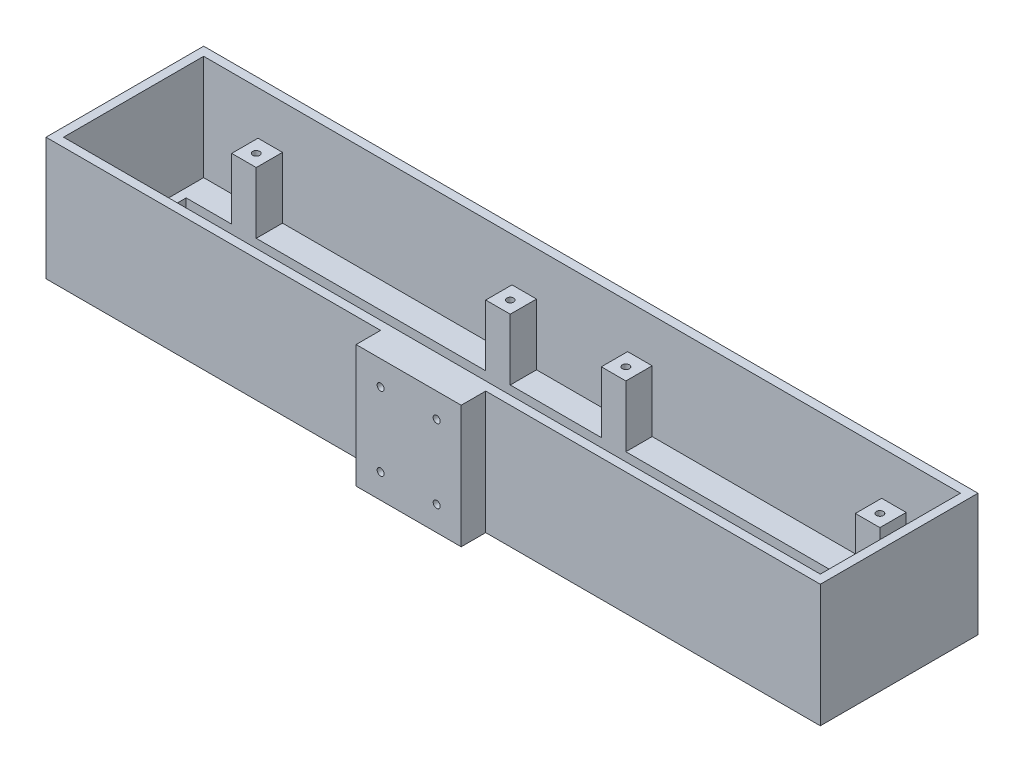
from build123d import *

# Parameters (mm, degrees)
SKETCH1_W           = 221
SKETCH1_H           = 45
BOSS_EXTRUDE1_DEPTH = 5
SKETCH2_W           = 211
SKETCH2_H           = 25
CUT_EXTRUDE1_DEPTH  = 2.5
SKETCH3_R           = 8
CUT_EXTRUDE2_DEPTH  = 2.5
SKETCH6_W           = 221
SKETCH6_H           = 45
SKETCH6_W_2         = 216
SKETCH6_H_2         = 40
BOSS_EXTRUDE3_DEPTH = 30
SKETCH7_W           = 7
SKETCH7_H           = 7.5
BOSS_EXTRUDE4_DEPTH = 17.5
SKETCH9_R           = 1
CUT_EXTRUDE3_DEPTH  = 6
SKETCH10_W          = 30
SKETCH10_H          = 35
BOSS_EXTRUDE5_DEPTH = 7
SKETCH11_R          = 1
CUT_EXTRUDE4_DEPTH  = 6


with BuildPart() as part:
    # Sketch1 → Boss-Extrude1 (new body)
    with BuildSketch(Plane(origin=(0, 0, 0), x_dir=(1, 0, 0), z_dir=(0, 1, 0))):
        Rectangle(SKETCH1_W, SKETCH1_H)
    extrude(amount=BOSS_EXTRUDE1_DEPTH)

    # Sketch2 → Cut-Extrude1 (cut)
    with BuildSketch(Plane(origin=(0, 5, 0), x_dir=(1, 0, 0), z_dir=(0, 1, 0))):
        Rectangle(SKETCH2_W, SKETCH2_H)
    extrude(amount=-CUT_EXTRUDE1_DEPTH, mode=Mode.SUBTRACT)

    # Sketch3 → Cut-Extrude2 (cut)
    with BuildSketch(Plane(origin=(0, 2.5, 0), x_dir=(1, 0, 0), z_dir=(0, 1, 0))):
        with Locations(Location((-53, 0, 0), (0, 0, 270))):
            Circle(SKETCH3_R)
        with Locations(Location((53, 0, 0), (0, 0, 270))):
            Circle(SKETCH3_R)
    extrude(amount=-CUT_EXTRUDE2_DEPTH, mode=Mode.SUBTRACT)

    # Sketch6 → Boss-Extrude3 (add)
    with BuildSketch(Plane(origin=(0, 5, 0), x_dir=(1, 0, 0), z_dir=(0, 1, 0))):
        Rectangle(SKETCH6_W, SKETCH6_H)
        Rectangle(SKETCH6_W_2, SKETCH6_H_2, mode=Mode.SUBTRACT)
    extrude(amount=BOSS_EXTRUDE3_DEPTH)

    # Sketch7 → Boss-Extrude4 (add)
    with BuildSketch(Plane(origin=(0, 5, 0), x_dir=(1, 0, 0), z_dir=(0, 1, 0))):
        with Locations((-89, 16.25)):
            Rectangle(SKETCH7_W, SKETCH7_H)
        with Locations((-89, -16.25)):
            Rectangle(SKETCH7_W, SKETCH7_H)
        with Locations((-16.5, 16.25)):
            Rectangle(SKETCH7_W, SKETCH7_H)
        with Locations((-16.5, -16.25)):
            Rectangle(SKETCH7_W, SKETCH7_H)
        with Locations((16.5, 16.25)):
            Rectangle(SKETCH7_W, SKETCH7_H)
        with Locations((16.5, -16.25)):
            Rectangle(SKETCH7_W, SKETCH7_H)
        with Locations((89, 16.25)):
            Rectangle(SKETCH7_W, SKETCH7_H)
        with Locations((89, -16.25)):
            Rectangle(SKETCH7_W, SKETCH7_H)
    extrude(amount=BOSS_EXTRUDE4_DEPTH)

    # Sketch9 → Cut-Extrude3 (cut)
    with BuildSketch(Plane(origin=(0, 22.5, 0), x_dir=(1, 0, 0), z_dir=(0, 1, 0))):
        with Locations(Location((-89, 16, 0), (0, 0, 270))):
            Circle(SKETCH9_R)
        with Locations(Location((-89, -16, 0), (0, 0, 270))):
            Circle(SKETCH9_R)
        with Locations(Location((-16.5, 16, 0), (0, 0, 270))):
            Circle(SKETCH9_R)
        with Locations(Location((-16.5, -16, 0), (0, 0, 270))):
            Circle(SKETCH9_R)
        with Locations(Location((16.5, 16, 0), (0, 0, 270))):
            Circle(SKETCH9_R)
        with Locations(Location((16.5, -16, 0), (0, 0, 270))):
            Circle(SKETCH9_R)
        with Locations(Location((89, 16, 0), (0, 0, 270))):
            Circle(SKETCH9_R)
        with Locations(Location((89, -16, 0), (0, 0, 270))):
            Circle(SKETCH9_R)
    extrude(amount=-CUT_EXTRUDE3_DEPTH, mode=Mode.SUBTRACT)

    # Sketch10 → Boss-Extrude5 (add)
    with BuildSketch(Plane.XY.offset(22.5)):
        with Locations((0, 17.5)):
            Rectangle(SKETCH10_W, SKETCH10_H)
    extrude(amount=BOSS_EXTRUDE5_DEPTH)

    # Sketch11 → Cut-Extrude4 (cut)
    with BuildSketch(Plane.XY.offset(29.5)):
        with Locations((-8, 28)):
            Circle(SKETCH11_R)
        with Locations((8, 28)):
            Circle(SKETCH11_R)
        with Locations((-8, 7)):
            Circle(SKETCH11_R)
        with Locations((8, 7)):
            Circle(SKETCH11_R)
    extrude(amount=-CUT_EXTRUDE4_DEPTH, mode=Mode.SUBTRACT)


solid = part.part
